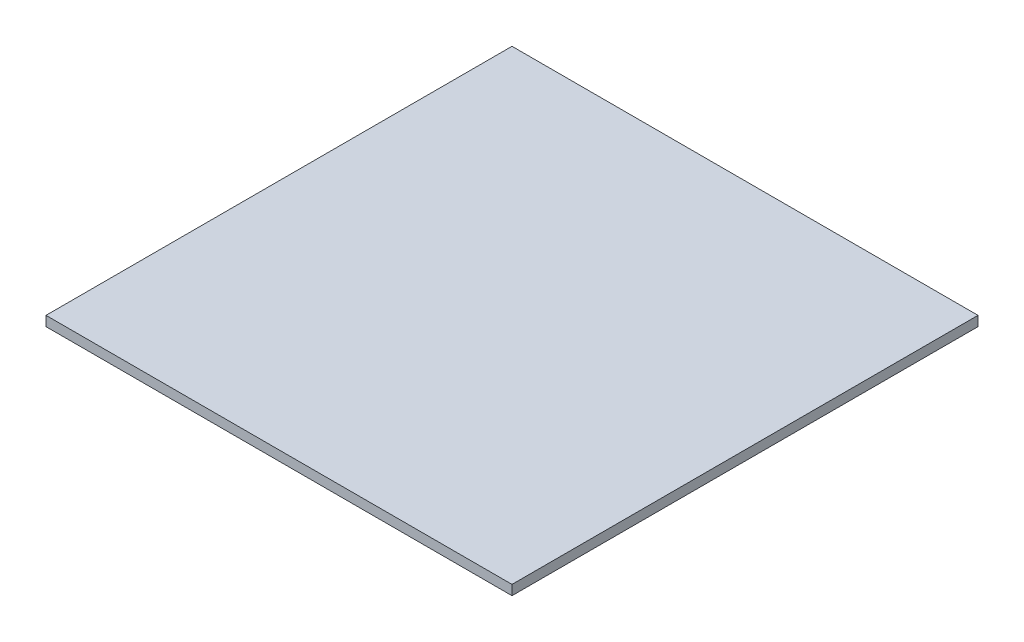
from build123d import *

# Parameters (mm, degrees)
SKETCH1_W            = 950
SKETCH1_H            = 20
REFERENCE_ONLY_DEPTH = 950


with BuildPart() as part:
    # Sketch1 → Reference_only (new body)
    with BuildSketch(Plane.XY):
        with Locations((475, 10)):
            Rectangle(SKETCH1_W, SKETCH1_H)
    extrude(amount=REFERENCE_ONLY_DEPTH)


solid = part.part
